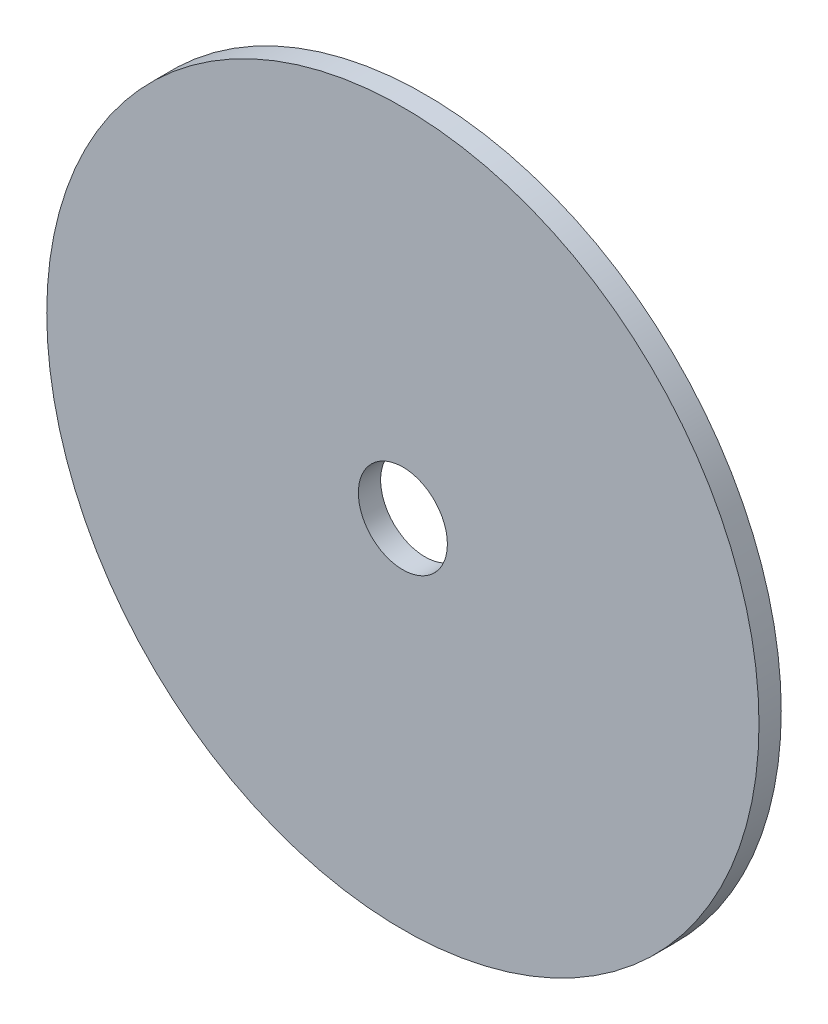
from build123d import *

# Parameters (mm, degrees)
SKETCH1_R           = 50.8
SKETCH1_R_2         = 6.35
BOSS_EXTRUDE2_DEPTH = 3.175


with BuildPart() as part:
    # Sketch1 → Boss-Extrude2 (new body)
    with BuildSketch(Plane.XY):
        Circle(SKETCH1_R)
        Circle(SKETCH1_R_2, mode=Mode.SUBTRACT)
    extrude(amount=BOSS_EXTRUDE2_DEPTH)


solid = part.part
